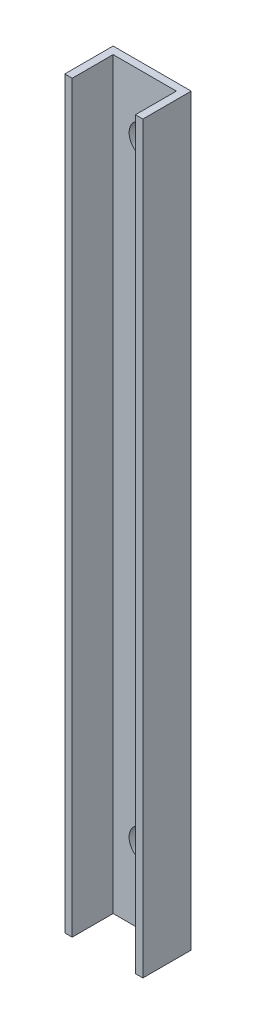
from build123d import *

# Parameters (mm, degrees)
EXTRUDE_THIN1_DEPTH = 100
SKETCH2_R           = 2.1
CUT_EXTRUDE1_DEPTH  = 10


with BuildPart() as part:
    # Sketch1 → Extrude-Thin1 (new body)
    with BuildSketch(Plane(origin=(0, 0, 0), x_dir=(1, 0, 0), z_dir=(0, 1, 0))):
        Polygon((-3.469957082, -1.813304721), (-3.469957082, 4.686695279), (7.030042918, 4.686695279), (7.030042918, -1.813304721), (6.030042918, -1.813304721), (6.030042918, 3.686695279), (-2.469957082, 3.686695279), (-2.469957082, -1.813304721), align=None)
    extrude(amount=EXTRUDE_THIN1_DEPTH)

    # Sketch2 → Cut-Extrude1 (cut)
    with BuildSketch(Plane(origin=(0, 0, -4.686695279), x_dir=(-1, 0, 0), z_dir=(0, 0, -1))):
        with Locations((-1.780042918, 92)):
            Circle(SKETCH2_R)
        with Locations((-1.780042918, 10)):
            Circle(SKETCH2_R)
    extrude(amount=-CUT_EXTRUDE1_DEPTH, mode=Mode.SUBTRACT)


solid = part.part
